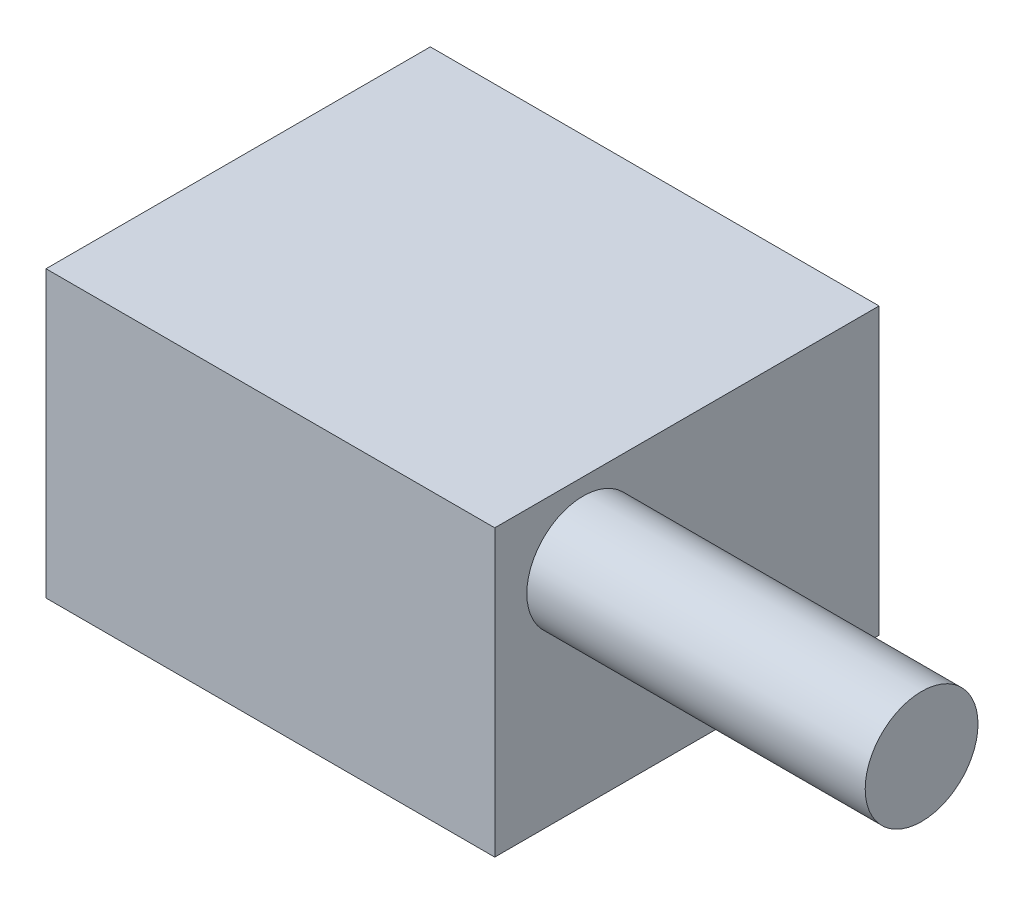
from build123d import *

# Parameters (mm, degrees)
SKETCH1_W           = 70.739
SKETCH1_H           = 60.579
BOSS_EXTRUDE1_DEPTH = 44.958
SKETCH2_R           = 8.89
BOSS_EXTRUDE2_DEPTH = 53.34


with BuildPart() as part:
    # Sketch1 → Boss-Extrude1 (new body)
    with BuildSketch(Plane(origin=(0, 0, 0), x_dir=(1, 0, 0), z_dir=(0, 1, 0))):
        Rectangle(SKETCH1_W, SKETCH1_H)
    extrude(amount=BOSS_EXTRUDE1_DEPTH)

    # Sketch2 → Boss-Extrude2 (add)
    with BuildSketch(Plane(origin=(35.3695, 0, 0), x_dir=(0, 0, -1), z_dir=(1, 0, 0))):
        with Locations(Location((-16.344897237, 33.441695374, 0), (0, 0, 180))):
            Circle(SKETCH2_R)
    extrude(amount=BOSS_EXTRUDE2_DEPTH)


solid = part.part
